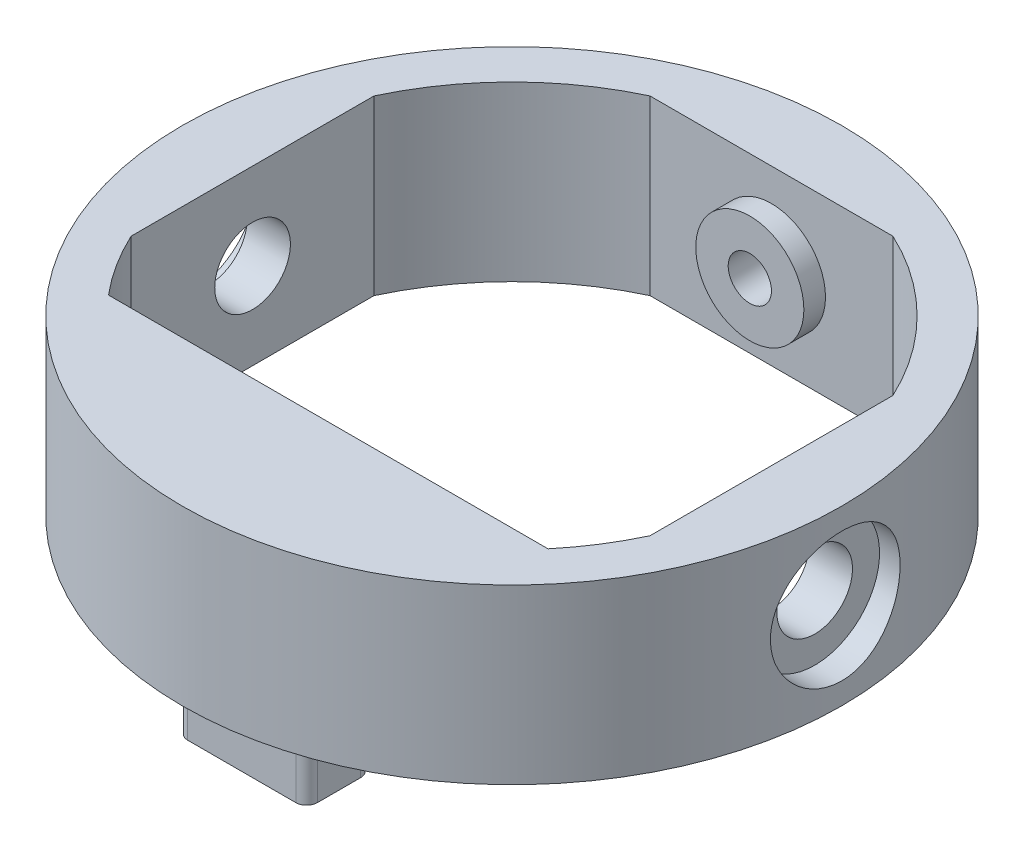
from build123d import *

# Parameters (mm, degrees)
SKETCH_1_R          = 15.25
EXTRUDE_1_DEPTH     = 4
CUT_EXTRUDE_1_DEPTH = 24.002717231
EXTRUDE_3_REACH     = 33.482
SKETCH_17_W         = 11.236102528
SKETCH_17_H         = 8
SKETCH_16_R         = 1
CUT_EXTRUDE_7_DEPTH = 22.93456194
EXTRUDE_START       = 1
SKETCH_18_R         = 2.5
SKETCH_18_R_2       = 1
EXTRUDE_4_DEPTH     = 1
SKETCH_19_W         = 6
SKETCH_19_H         = 3
EXTRUDE_5_DEPTH     = 4
FILLET_1_R          = 0.5


with BuildPart() as part:
    # 草图1 → 凸台-拉伸1 (new, symmetric)
    with BuildSketch(Plane(origin=(0, 0, 0), x_dir=(1, 0, 0), z_dir=(0, 1, 0))):
        with Locations(Location((0, 0, 0), (0, 0, 270))):
            Circle(SKETCH_1_R)
    extrude(amount=EXTRUDE_1_DEPTH, both=True)

    # 草图2 → 切除-拉伸1 (cut, through all)
    with BuildSketch(Plane(origin=(0, 4, 0), x_dir=(1, 0, 0), z_dir=(0, 1, 0))):
        with BuildLine():
            Line((-12, 5.618051264), (-12, -5.618051264))
            ThreePointArc((-12, -5.618051264), (-11.175427785, -7.118448835), (-10.164275675, -8.5))
            Line((-10.164275675, -8.5), (10.164275675, -8.5))
            ThreePointArc((10.164275675, -8.5), (11.175427785, -7.118448835), (12, -5.618051264))
            Line((12, -5.618051264), (12, 5.618051264))
            ThreePointArc((12, 5.618051264), (0, 13.25), (-12, 5.618051264))
        make_face()
    extrude(amount=-CUT_EXTRUDE_1_DEPTH, mode=Mode.SUBTRACT)

    # 草图3 → 切除-旋转4 (revolve, cut)
    with BuildSketch(Plane(origin=(0, 0, 0), x_dir=(1, 0, 0), z_dir=(0, 1, 0)), mode=Mode.PRIVATE) as cut_revolve_4_sk:
        Polygon((12, 0), (12, 1.75), (14, 1.75), (14, 3), (20, 3), (20, 0), align=None)
    cut_revolve_4 = revolve(cut_revolve_4_sk.sketch.rotate(Axis((0, 0, 0), (1, 0, 0)), 180), axis=Axis((0, 0, 0), (1, 0, 0)), mode=Mode.SUBTRACT)

    # 镜向1: 切除-旋转4 across plane
    add(cut_revolve_4.mirror(Plane(origin=(0, 0, 0), x_dir=(0, 0, 1), z_dir=(1, 0, 0))), mode=Mode.SUBTRACT)

    # 草图17 → 凸台-拉伸3 (add, up to next)
    with BuildSketch(Plane.XY.offset(-12), mode=Mode.PRIVATE) as extrude_3_sk1:
        Rectangle(SKETCH_17_W, SKETCH_17_H)
    extrude_3_tool1 = extrude(extrude_3_sk1.sketch, amount=-EXTRUDE_3_REACH, mode=Mode.PRIVATE) - part.part
    add(extrude_3_tool1.solids().sort_by_distance((0, 0, -12))[0])

    # 草图16 → 切除-拉伸7 (cut, through all)
    with BuildSketch(Plane.XY):
        Circle(SKETCH_16_R)
    extrude(amount=-CUT_EXTRUDE_7_DEPTH, mode=Mode.SUBTRACT)

    # 草图18 → 凸台-拉伸4 (add)
    with BuildSketch(Plane.XY.offset(-12).offset(EXTRUDE_START)):
        Circle(SKETCH_18_R)
        Circle(SKETCH_18_R_2, mode=Mode.SUBTRACT)
    extrude(amount=-EXTRUDE_4_DEPTH)

    # 草图19 → 凸台-拉伸5 (add)
    with BuildSketch(Plane.XZ.offset(4)):
        with Locations((0, 11)):
            Rectangle(SKETCH_19_W, SKETCH_19_H)
    extrude(amount=EXTRUDE_5_DEPTH)

    # 圆角1
    fillet_1_edges = [part.edges().sort_by_distance(p)[0] for p in [
        (3, -6, 9.5),
        (3, -6, 12.5),
        (-3, -6, 12.5),
        (-3, -6, 9.5),
    ]]
    fillet(fillet_1_edges, radius=FILLET_1_R)


solid = part.part
